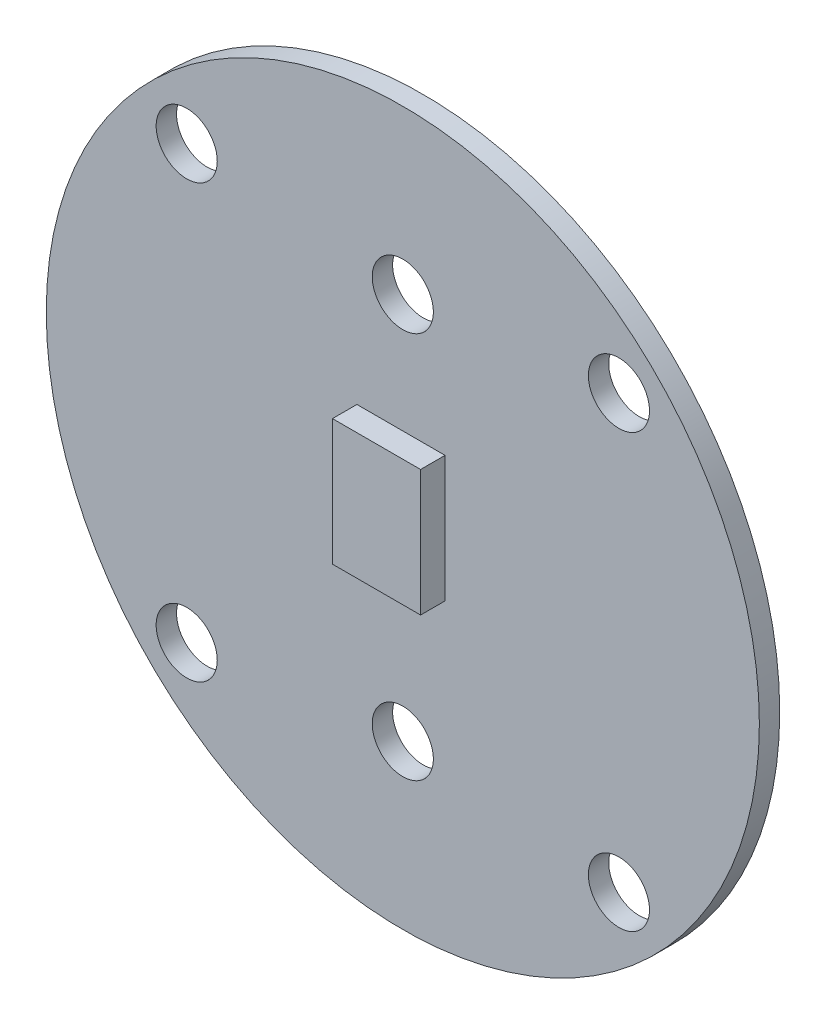
from build123d import *

# Parameters (mm, degrees)
SKETCH_1_R      = 17.5
SKETCH_1_R_2    = 1.5
EXTRUDE_1_DEPTH = 1
SKETCH_2_W      = 4.325123413
SKETCH_2_H      = 6.187329326
EXTRUDE_2_DEPTH = 1.2


with BuildPart() as part:
    # 草图1 → 凸台-拉伸1 (new body)
    with BuildSketch(Plane.XY):
        Circle(SKETCH_1_R)
        with Locations((0, 9.5)):
            Circle(SKETCH_1_R_2, mode=Mode.SUBTRACT)
        with Locations((0, -9.5)):
            Circle(SKETCH_1_R_2, mode=Mode.SUBTRACT)
        with Locations((10.606601718, 10.606601718)):
            Circle(SKETCH_1_R_2, mode=Mode.SUBTRACT)
        with Locations((10.606601718, -10.606601718)):
            Circle(SKETCH_1_R_2, mode=Mode.SUBTRACT)
        with Locations((-10.606601718, -10.606601718)):
            Circle(SKETCH_1_R_2, mode=Mode.SUBTRACT)
        with Locations((-10.606601718, 10.606601718)):
            Circle(SKETCH_1_R_2, mode=Mode.SUBTRACT)
    extrude(amount=EXTRUDE_1_DEPTH)

    # 草图2 → 凸台-拉伸2 (add)
    with BuildSketch(Plane.XY.offset(1)):
        with Locations((-0.090106737, 0.600711585)):
            Rectangle(SKETCH_2_W, SKETCH_2_H)
    extrude(amount=EXTRUDE_2_DEPTH)


solid = part.part
